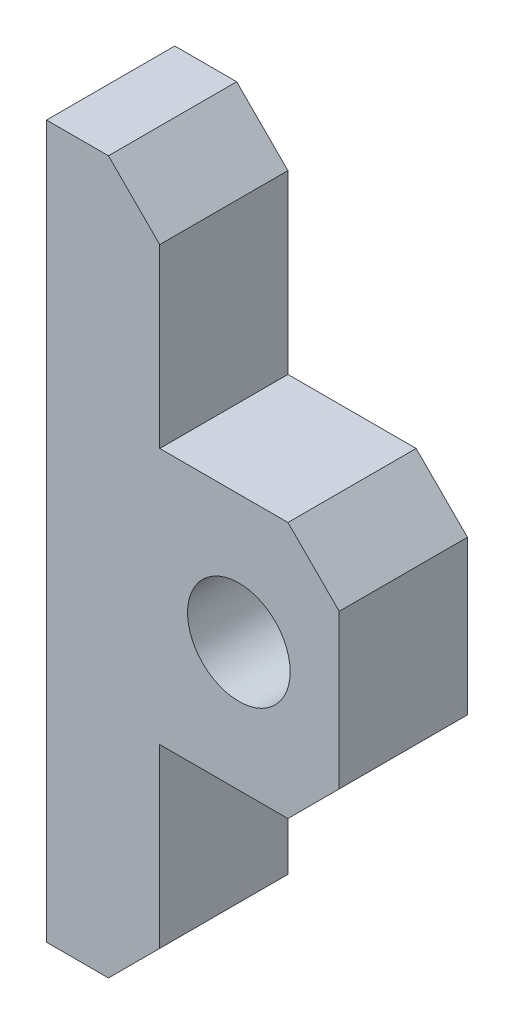
from build123d import *

# Parameters (mm, degrees)
SKETCH_1_W          = 10
SKETCH_1_H          = 55.540767131
EXTRUDE_1_DEPTH     = 25
SKETCH_5_R          = 4.000000001
CUT_EXTRUDE_2_DEPTH = 74.509784895
CUT_EXTRUDE_3_DEPTH = 74.509784895
CHAMFER_1_SIZE      = 4


with BuildPart() as part:
    # Эскиз1 → Вытянуть1 (new body)
    with BuildSketch(Plane(origin=(0, 0, 0), x_dir=(0, 0, -1), z_dir=(1, 0, 0))):
        with Locations((-15, -40.630555576)):
            Rectangle(SKETCH_1_W, SKETCH_1_H)
    extrude(amount=EXTRUDE_1_DEPTH)

    # Эскиз5 → Вырез-Вытянуть2 (cut, through all)
    with BuildSketch(Plane.XY.offset(20)):
        with Locations((15, -40.630555576)):
            Circle(SKETCH_5_R)
    extrude(amount=-CUT_EXTRUDE_2_DEPTH, mode=Mode.SUBTRACT)

    # Эскиз6 → Вырез-Вытянуть3 (cut, through all)
    with BuildSketch(Plane.XY.offset(20)):
        Polygon((22.828613207, -50.630555576), (22.828613207, -30.630555576), (8.828613207, -30.630555576), (8.828613207, -12.86017201), (25, -12.86017201), (25, -68.400939141), (8.828613207, -68.400939141), (8.828613207, -50.630555576), align=None)
    extrude(amount=-CUT_EXTRUDE_3_DEPTH, mode=Mode.SUBTRACT)

    # Фаска1
    chamfer_1_edges = [part.edges().sort_by_distance(p)[0] for p in [
        (22.828613207, -30.630555576, 15),
        (8.828613207, -12.86017201, 15),
        (8.828613207, -68.400939141, 15),
        (22.828613207, -50.630555576, 15),
    ]]
    chamfer(chamfer_1_edges, length=CHAMFER_1_SIZE)


solid = part.part
